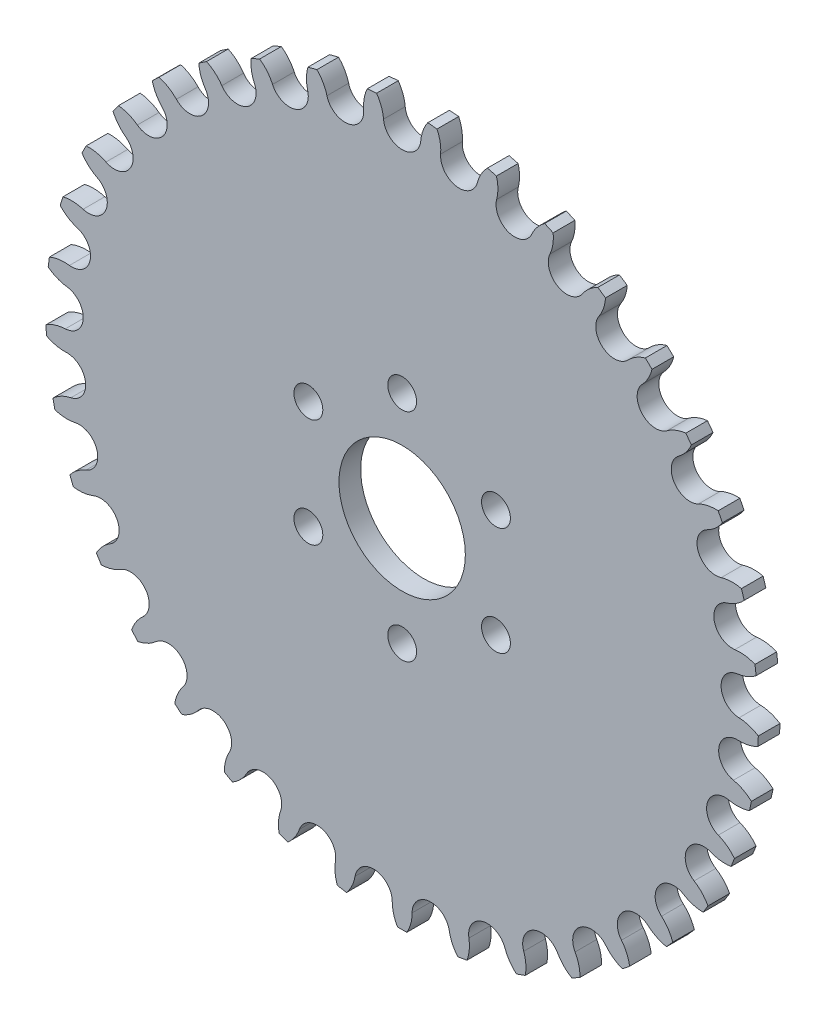
from build123d import *

# Parameters (mm, degrees)
EXTRUDE_1_DEPTH          = 6
PATTERN_CIRCULAR_1_COUNT = 37
SKETCH_3_R               = 17.5
SKETCH_3_R_2             = 4
CUT_EXTRUDE_1_DEPTH      = 140.64784044


with BuildPart() as part:
    # Эскиз2 → Бобышка-Вытянуть1 (new body)
    with BuildSketch(Plane.XY):
        with BuildLine():
            Line((0, 0), (0, 88.416055336))
            ThreePointArc((0, 88.416055336), (3.504058612, 89.781088331), (5.161338991, 93.156760647))
            ThreePointArc((5.161338991, 93.156760647), (5.771295055, 95.917261775), (7.08324249, 98.421499544))
            ThreePointArc((7.08324249, 98.421499544), (8.368314096, 98.320573716), (9.651957665, 98.202869662))
            ThreePointArc((9.651957665, 98.202869662), (10.521815693, 95.512932881), (10.65647114, 92.689055973))
            ThreePointArc((10.65647114, 92.689055973), (11.719421659, 89.081857888), (14.942385881, 87.144270869))
            Line((14.942385881, 87.144270869), (0, 0))
        make_face()
    extrude_1 = extrude(amount=EXTRUDE_1_DEPTH)

    # Круговой массив1: Бобышка-Вытянуть1 ×37 about axis
    pattern_circular_1_axis = Axis((0, 0, 0), (0, 0, 1))
    for i in range(1, PATTERN_CIRCULAR_1_COUNT):
        add(extrude_1.rotate(pattern_circular_1_axis, i * 360 / PATTERN_CIRCULAR_1_COUNT))

    # Эскиз3 → Вырез-Вытянуть1 (cut, through all)
    with BuildSketch(Plane.XY.offset(6)):
        Circle(SKETCH_3_R)
        with Locations((0, 30)):
            Circle(SKETCH_3_R_2)
        with Locations((25.980762114, 15)):
            Circle(SKETCH_3_R_2)
        with Locations((25.980762114, -15)):
            Circle(SKETCH_3_R_2)
        with Locations((0, -30)):
            Circle(SKETCH_3_R_2)
        with Locations((-25.980762114, -15)):
            Circle(SKETCH_3_R_2)
        with Locations((-25.980762114, 15)):
            Circle(SKETCH_3_R_2)
    extrude(amount=-CUT_EXTRUDE_1_DEPTH, mode=Mode.SUBTRACT)


solid = part.part
